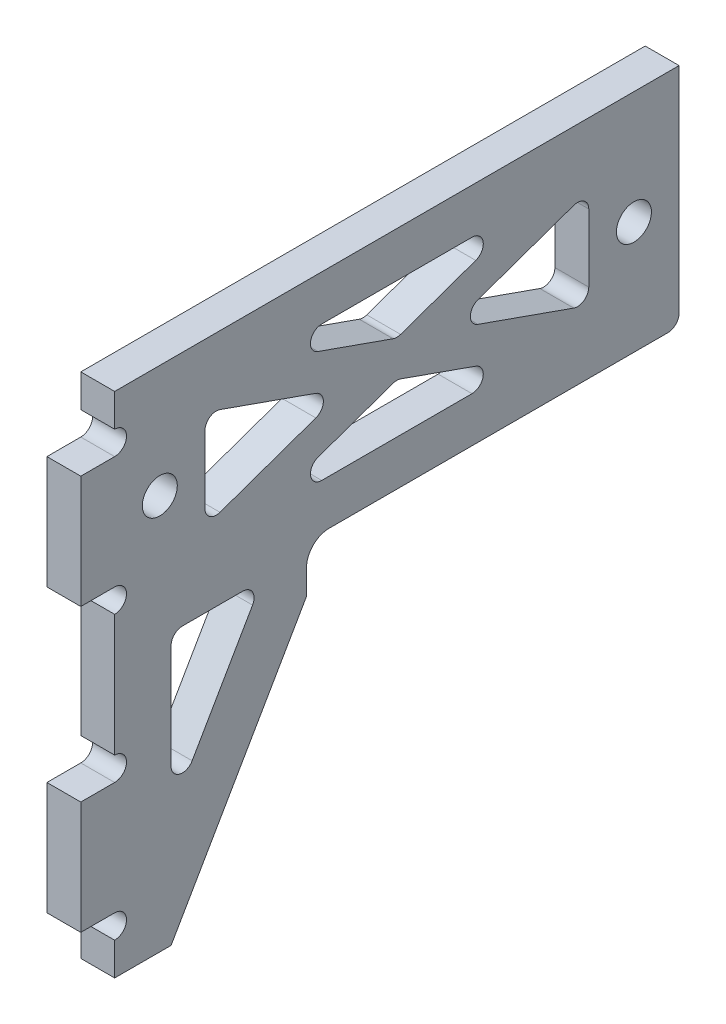
from build123d import *

# Parameters (mm, degrees)
SKETCH_1_R      = 1.55
EXTRUDE_1_DEPTH = 3
FILLET_1_R      = 1
FILLET_2_R      = 2


with BuildPart() as part:
    # 草图1 → 凸台-拉伸1 (new body)
    with BuildSketch(Plane(origin=(0, 0, 0), x_dir=(0, 0, -1), z_dir=(1, 0, 0))):
        with BuildLine():
            Line((-8, -10), (25, -10))
            Line((25, -10), (25, 10))
            Line((25, 10), (-25, 10))
            Line((-25, 10), (-25, 7.1))
            ThreePointArc((-25, 7.1), (-23.95, 6.05), (-25, 5))
            Line((-25, 5), (-28, 5))
            Line((-28, 5), (-28, -5))
            Line((-28, -5), (-25, -5))
            ThreePointArc((-25, -5), (-23.95, -6.05), (-25, -7.1))
            Line((-25, -7.1), (-25, -17.9))
            ThreePointArc((-25, -17.9), (-23.95, -18.95), (-25, -20))
            Line((-25, -20), (-28, -20))
            Line((-28, -20), (-28, -30))
            Line((-28, -30), (-25, -30))
            ThreePointArc((-25, -30), (-23.95, -31.05), (-25, -32.1))
            Line((-25, -32.1), (-25, -35))
            Line((-25, -35), (-20, -35))
            Line((-20, -35), (-8, -14.215390309))
            Line((-8, -14.215390309), (-8, -10))
        make_face()
        with Locations((-21, 0)):
            Circle(SKETCH_1_R, mode=Mode.SUBTRACT)
        Polygon((-4.506939094, 0), (-17, -4.409315614), (-17, 4.409315614), align=None, mode=Mode.SUBTRACT)
        Polygon((12.493060906, -6), (-12.493060906, -6), (0, -1.590684386), align=None, mode=Mode.SUBTRACT)
        Polygon((0, 1.590684386), (-12.493060906, 6), (12.493060906, 6), align=None, mode=Mode.SUBTRACT)
        Polygon((17, 4.409315614), (17, -4.409315614), (4.506939094, 0), align=None, mode=Mode.SUBTRACT)
        with Locations((21, 0)):
            Circle(SKETCH_1_R, mode=Mode.SUBTRACT)
        Polygon((-20, -25), (-20, -11), (-11.917096231, -11), align=None, mode=Mode.SUBTRACT)
    extrude(amount=EXTRUDE_1_DEPTH)

    # 圆角1
    fillet_1_edges = [part.edges().sort_by_distance(p)[0] for p in [
        (1.5, -11, 20),
        (1.5, -25, 20),
        (1.5, -11, 11.917096231),
        (1.5, 6, -12.493060906),
        (1.5, 6, 12.493060906),
        (1.5, 1.590684386, 0),
        (1.5, -4.409315614, 17),
        (1.5, 0, 4.506939094),
        (1.5, 4.409315614, 17),
        (1.5, -4.409315614, -17),
        (1.5, 4.409315614, -17),
        (1.5, 0, -4.506939094),
        (1.5, -6, 12.493060906),
        (1.5, -6, -12.493060906),
        (1.5, -1.590684386, 0),
        (1.5, -10, -25),
    ]]
    fillet(fillet_1_edges, radius=FILLET_1_R)

    # 圆角2
    fillet_2_edges = [part.edges().sort_by_distance(p)[0] for p in [
        (1.5, -10, 8),
    ]]
    fillet(fillet_2_edges, radius=FILLET_2_R)


solid = part.part
